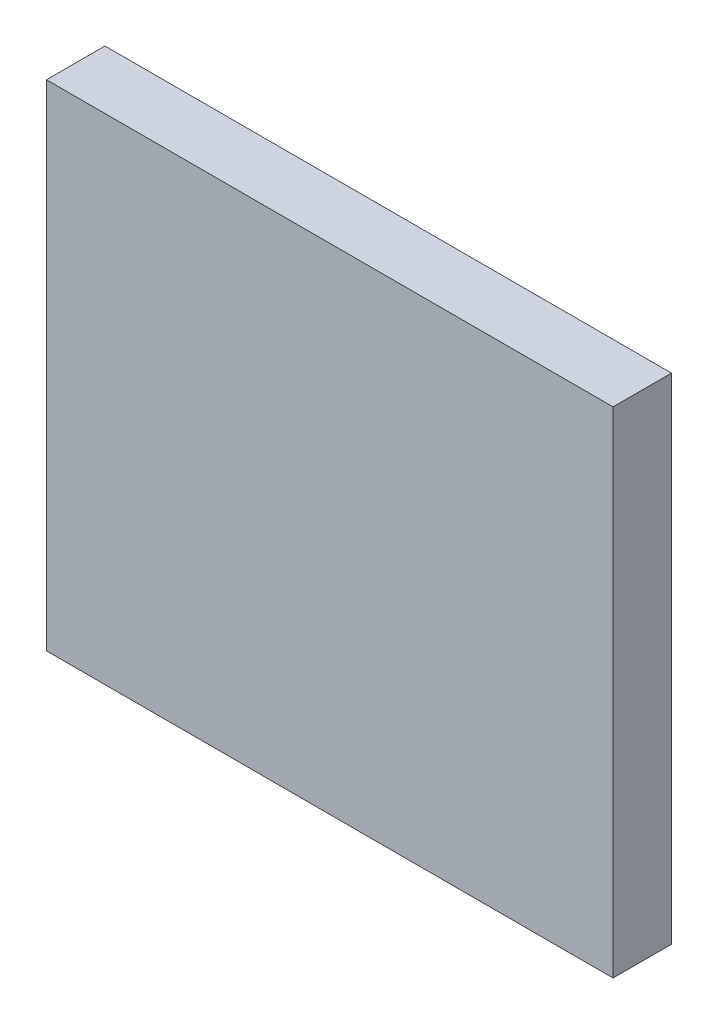
from build123d import *

# Parameters (mm, degrees)
SKETCH1_W           = 63
SKETCH1_H           = 55
BOSS_EXTRUDE1_DEPTH = 6.5


with BuildPart() as part:
    # Sketch1 → Boss-Extrude1 (new body)
    with BuildSketch(Plane.XY):
        Rectangle(SKETCH1_W, SKETCH1_H)
    extrude(amount=BOSS_EXTRUDE1_DEPTH)


solid = part.part
